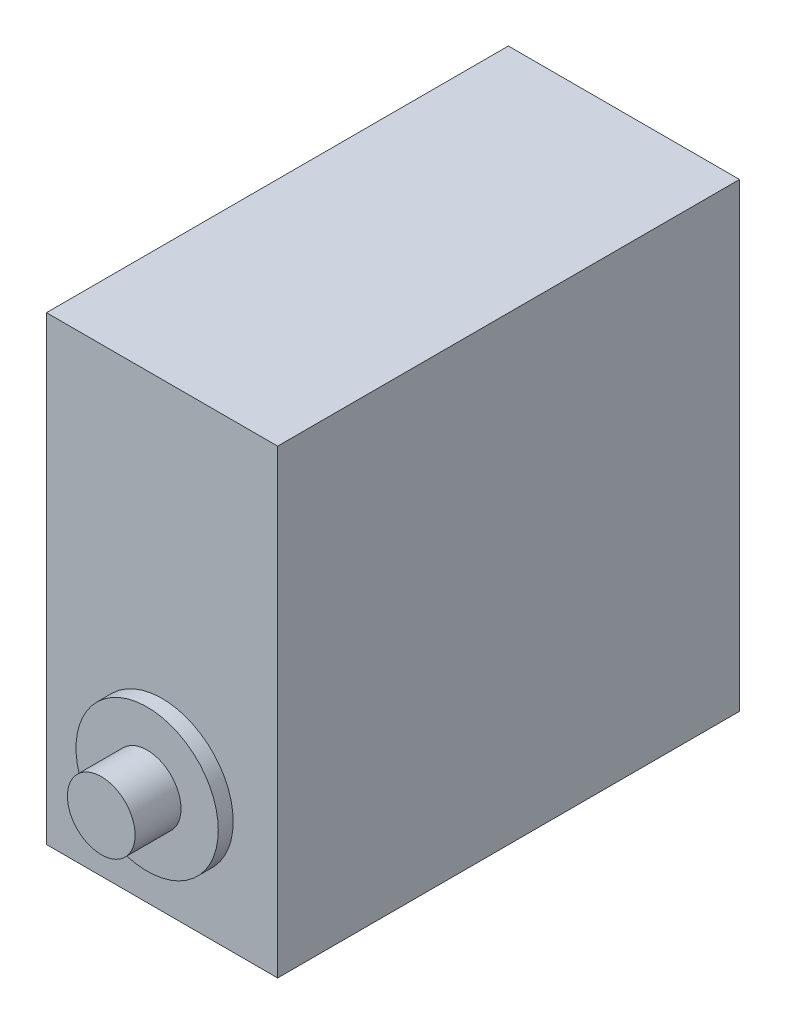
from build123d import *

# Parameters (mm, degrees)
SKETCH1_W           = 40.15
SKETCH1_H           = 20.15
BOSS_EXTRUDE1_DEPTH = 20.13
SKETCH2_R           = 6.2
BOSS_EXTRUDE2_DEPTH = 1.3
SKETCH3_R           = 3
BOSS_EXTRUDE3_DEPTH = 4
SKETCH7_R           = 2.95
BOSS_EXTRUDE4_DEPTH = 4


with BuildPart() as part:
    # Sketch1 → Boss-Extrude1 (new, symmetric)
    with BuildSketch(Plane(origin=(0, 0, 0), x_dir=(0, 1, 0), z_dir=(0, 0, 1))):
        Rectangle(SKETCH1_W, SKETCH1_H)
    extrude(amount=BOSS_EXTRUDE1_DEPTH, both=True)

    # Sketch2 → Boss-Extrude2 (add)
    with BuildSketch(Plane.XY.offset(20.13)):
        with Locations((0, -10.205)):
            Circle(SKETCH2_R)
    boss_extrude2 = extrude(amount=BOSS_EXTRUDE2_DEPTH)

    # Mirror1: Boss-Extrude2 across plane
    add(boss_extrude2.mirror(Plane.XY))

    # Sketch3 → Boss-Extrude3 (add)
    with BuildSketch(Plane(origin=(0, 0, -21.43), x_dir=(1, 0, 0), z_dir=(0, 0, -1))):
        with Locations(Location((0, 10.205, 0), (0, 0, 180))):
            Circle(SKETCH3_R)
    extrude(amount=BOSS_EXTRUDE3_DEPTH)

    # Sketch7 → Boss-Extrude4 (add)
    with BuildSketch(Plane.XY.offset(21.43)):
        with Locations((0, -10.205)):
            Circle(SKETCH7_R)
    extrude(amount=BOSS_EXTRUDE4_DEPTH)


solid = part.part
